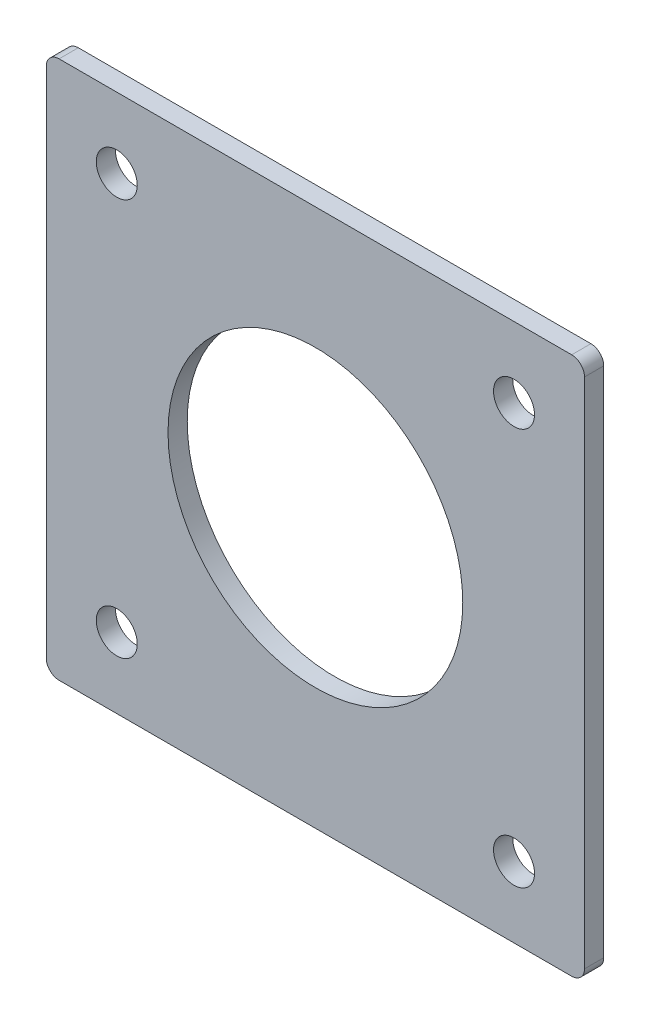
from build123d import *

# Parameters (mm, degrees)
SKETCH_1_W      = 42
SKETCH_1_H      = 42
SKETCH_1_R      = 1.6
SKETCH_1_R_2    = 11.5
EXTRUDE_1_DEPTH = 1.5
FILLET_1_R      = 1


with BuildPart() as part:
    # 草图1 → 凸台-拉伸1 (new body)
    with BuildSketch(Plane.XY):
        with Locations((-23.141791045, 5.485074627)):
            Rectangle(SKETCH_1_W, SKETCH_1_H)
        with Locations((-38.641791045, 20.985074627)):
            Circle(SKETCH_1_R, mode=Mode.SUBTRACT)
        with Locations((-23.141791045, 5.485074627)):
            Circle(SKETCH_1_R_2, mode=Mode.SUBTRACT)
        with Locations(Location((-7.641791045, 20.985074627, 0), (0, 0, 180))):
            Circle(SKETCH_1_R, mode=Mode.SUBTRACT)
        with Locations((-7.641791045, -10.014925373)):
            Circle(SKETCH_1_R, mode=Mode.SUBTRACT)
        with Locations(Location((-38.641791045, -10.014925373, 0), (0, 0, 180))):
            Circle(SKETCH_1_R, mode=Mode.SUBTRACT)
    extrude(amount=EXTRUDE_1_DEPTH)

    # 圆角1
    fillet_1_edges = [part.edges().sort_by_distance(p)[0] for p in [
        (-44.141791045, 26.485074627, 0.75),
        (-2.141791045, 26.485074627, 0.75),
        (-2.141791045, -15.514925373, 0.75),
        (-44.141791045, -15.514925373, 0.75),
    ]]
    fillet(fillet_1_edges, radius=FILLET_1_R)


solid = part.part
